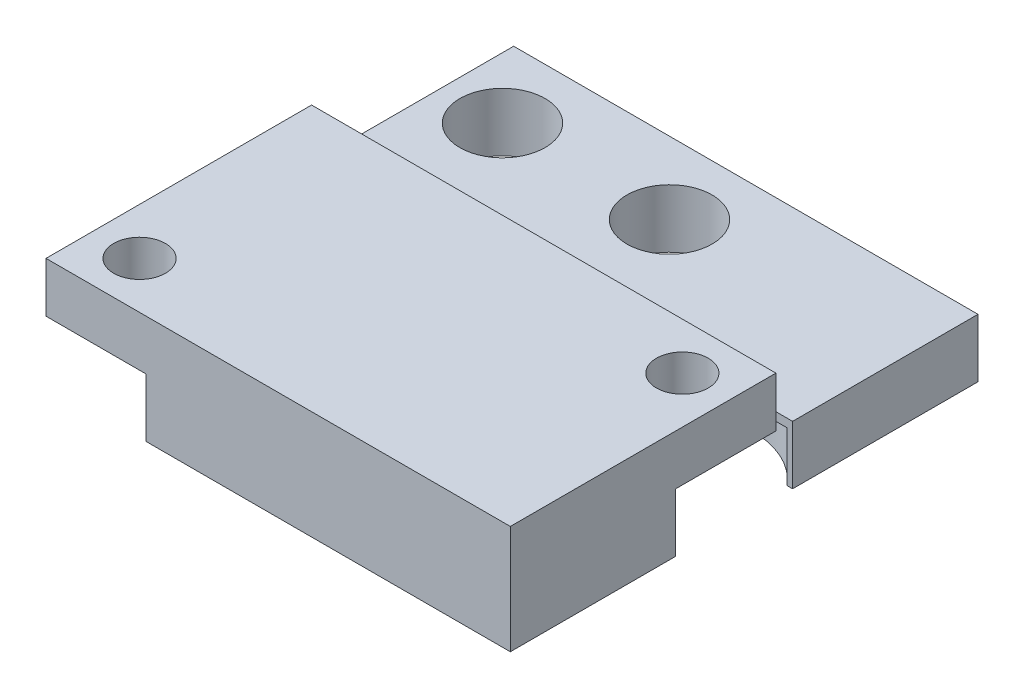
from build123d import *

# Parameters (mm, degrees)
SKETCH1_W           = 27.8
SKETCH1_H           = 28
SKETCH1_R           = 2.55
BOSS_EXTRUDE1_DEPTH = 3.5
SKETCH2_W           = 27.8
SKETCH2_H           = 15.9
SKETCH2_R           = 1.55
BOSS_EXTRUDE2_DEPTH = 3
SKETCH3_W           = 6
SKETCH3_H           = 6
CUT_EXTRUDE5_DEPTH  = 3.5
SKETCH4_W           = 6
SKETCH4_H           = 6
SKETCH4_H_2         = 1
CUT_EXTRUDE7_DEPTH  = 3.5
SKETCH5_R           = 2.55
SKETCH5_R_2         = 5
CUT_EXTRUDE8_DEPTH  = 3


with BuildPart() as part:
    # Sketch1 → Boss-Extrude1 (new body)
    with BuildSketch(Plane(origin=(0, 0, 0), x_dir=(1, 0, 0), z_dir=(0, 1, 0))):
        with Locations((13.9, 14)):
            Rectangle(SKETCH1_W, SKETCH1_H)
        with Locations(Location((13.65, 23.68, 0), (0, 0, 270))):
            Circle(SKETCH1_R, mode=Mode.SUBTRACT)
        with Locations(Location((3.65, 23.68, 0), (0, 0, 270))):
            Circle(SKETCH1_R, mode=Mode.SUBTRACT)
    extrude(amount=BOSS_EXTRUDE1_DEPTH)

    # Sketch2 → Boss-Extrude2 (add)
    with BuildSketch(Plane(origin=(0, 3.5, 0), x_dir=(1, 0, 0), z_dir=(0, 1, 0))):
        with Locations((13.9, 7.95)):
            Rectangle(SKETCH2_W, SKETCH2_H)
        with Locations(Location((2.8, 2.8, 0), (0, 0, 270))):
            Circle(SKETCH2_R, mode=Mode.SUBTRACT)
        with Locations(Location((25, 13.1, 0), (0, 0, 270))):
            Circle(SKETCH2_R, mode=Mode.SUBTRACT)
    extrude(amount=BOSS_EXTRUDE2_DEPTH)

    # Sketch3 → Cut-Extrude5 (cut)
    with BuildSketch(Plane.XZ):
        with Locations((3, -3)):
            Rectangle(SKETCH3_W, SKETCH3_H)
    extrude(amount=-CUT_EXTRUDE5_DEPTH, mode=Mode.SUBTRACT)

    # Sketch4 → Cut-Extrude7 (cut)
    with BuildSketch(Plane.XZ):
        with Locations((24.8, -12.9)):
            Rectangle(SKETCH4_W, SKETCH4_H)
        with Locations((24.8, -16.4)):
            Rectangle(SKETCH4_W, SKETCH4_H_2)
    extrude(amount=-CUT_EXTRUDE7_DEPTH, mode=Mode.SUBTRACT)

    # Sketch5 → Cut-Extrude8 (cut)
    with BuildSketch(Plane.XZ):
        with Locations(Location((13.65, -23.68, 0), (0, 0, 90))):
            Circle(SKETCH5_R)
        with Locations((23.65, -13.68)):
            Circle(SKETCH5_R_2)
    extrude(amount=-CUT_EXTRUDE8_DEPTH, mode=Mode.SUBTRACT)


solid = part.part
